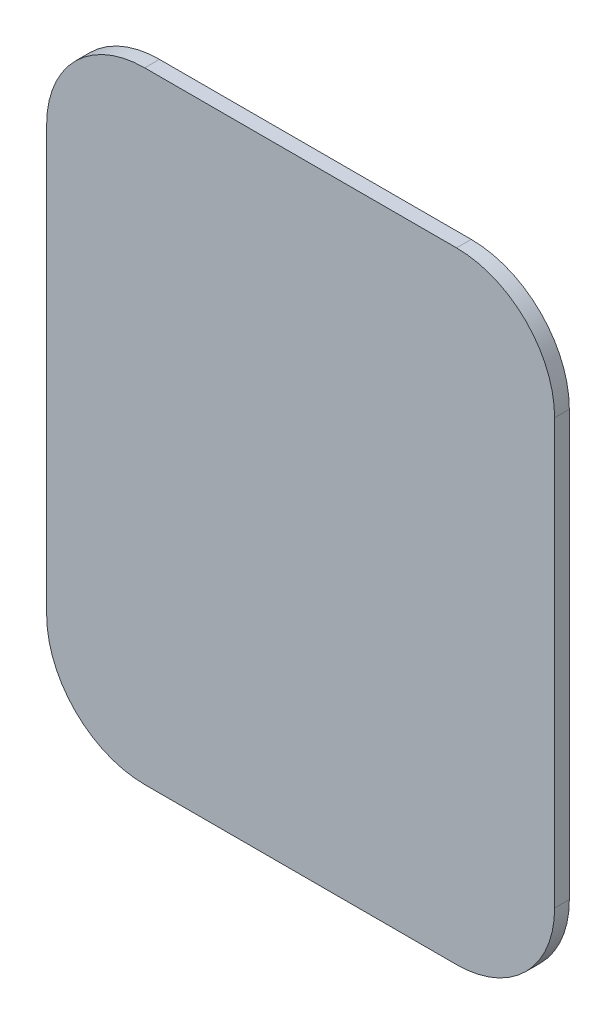
from build123d import *

# Parameters (mm, degrees)
SKETCH_1_W      = 103.6
SKETCH_1_H      = 126.6
EXTRUDE_1_DEPTH = 3
FILLET_1_R      = 20


with BuildPart() as part:
    # 草图1 → 凸台-拉伸1 (new body)
    with BuildSketch(Plane.XY):
        Rectangle(SKETCH_1_W, SKETCH_1_H)
    extrude(amount=EXTRUDE_1_DEPTH)

    # 圆角1
    fillet_1_edges = [part.edges().sort_by_distance(p)[0] for p in [
        (51.8, -63.3, 1.5),
        (-51.8, -63.3, 1.5),
        (-51.8, 63.3, 1.5),
        (51.8, 63.3, 1.5),
    ]]
    fillet(fillet_1_edges, radius=FILLET_1_R)


solid = part.part
